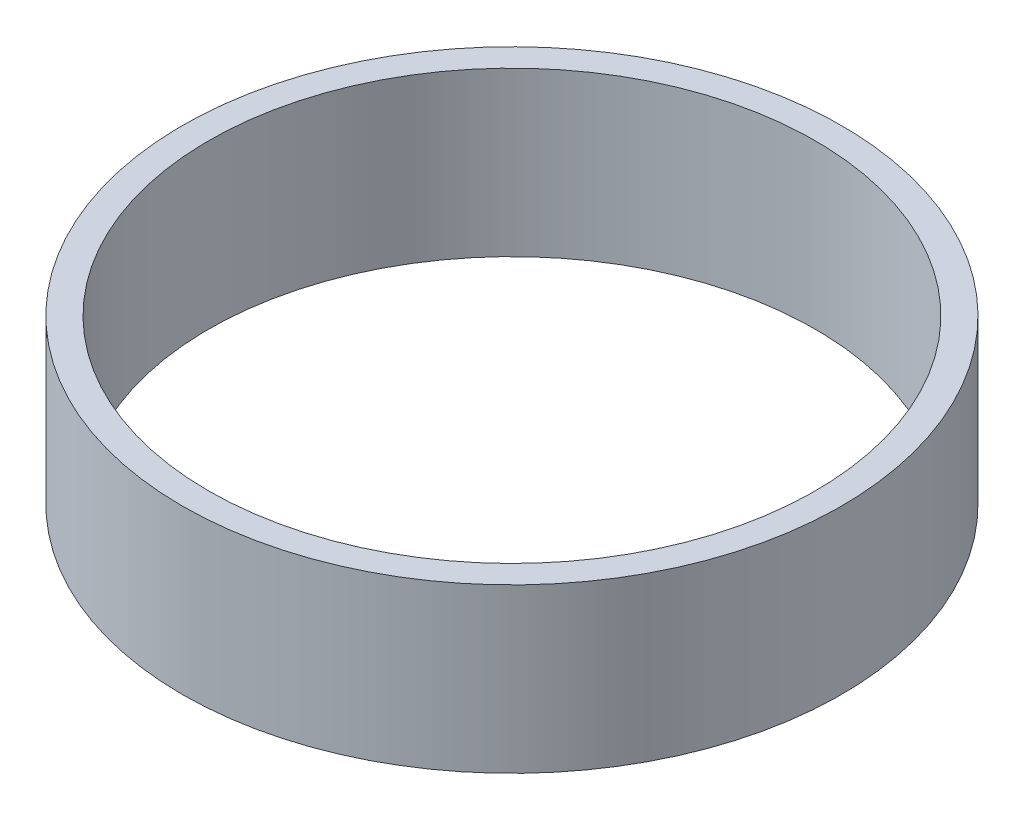
from build123d import *

# Parameters (mm, degrees)
ESQUISSE1_R             = 12.115
BOSS_EXTRU_1_DEPTH      = 6
ESQUISSE2_R             = 11.15
ENL_V_MAT_EXTRU_1_DEPTH = 10


with BuildPart() as part:
    # Esquisse1 → Boss.-Extru.1 (new body)
    with BuildSketch(Plane(origin=(0, 0, 0), x_dir=(1, 0, 0), z_dir=(0, 1, 0))):
        with Locations(Location((0, 0, 0), (0, 0, 270))):
            Circle(ESQUISSE1_R)
    extrude(amount=BOSS_EXTRU_1_DEPTH)

    # Esquisse2 → Enlèv. mat.-Extru.1 (cut)
    with BuildSketch(Plane(origin=(0, 6, 0), x_dir=(1, 0, 0), z_dir=(0, 1, 0))):
        with Locations(Location((0, 0, 0), (0, 0, 270))):
            Circle(ESQUISSE2_R)
    extrude(amount=-ENL_V_MAT_EXTRU_1_DEPTH, mode=Mode.SUBTRACT)


solid = part.part
